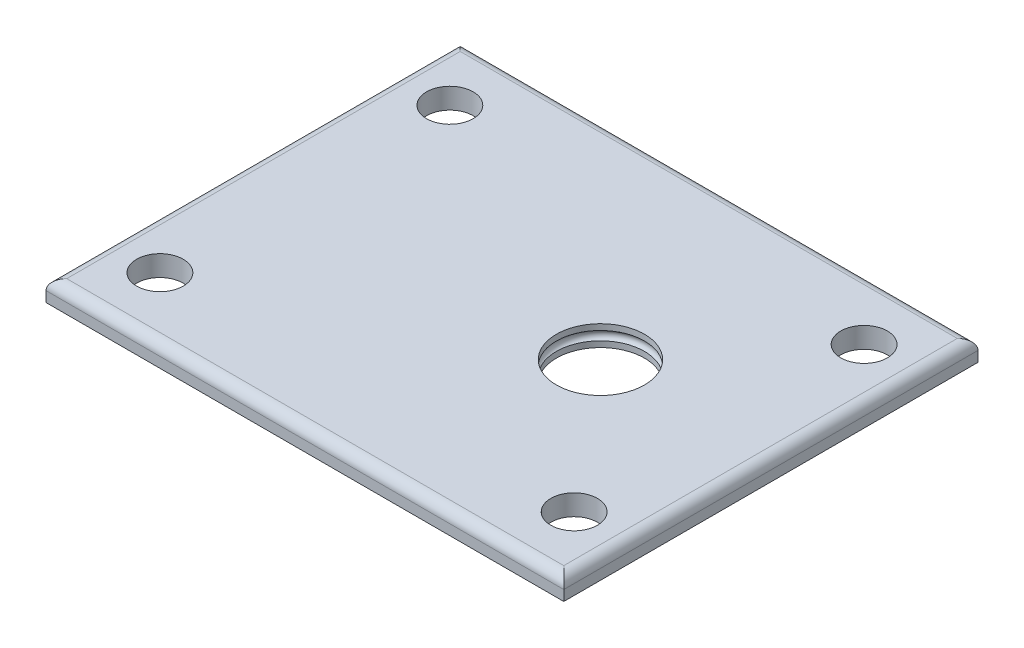
from build123d import *

# Parameters (mm, degrees)
SKETCH2_W           = 50
SKETCH2_H           = 40
SKETCH2_R           = 2.25
BOSS_EXTRUDE1_DEPTH = 2
CUT_EXTRUDE3_REACH  = 58.436
SKETCH4_R           = 4.25
FILLET2_R           = 1


with BuildPart() as part:
    # Sketch2 → Boss-Extrude1 (new body)
    with BuildSketch(Plane(origin=(0, 0, 0), x_dir=(1, 0, 0), z_dir=(0, 1, 0))):
        with Locations((20, -14)):
            Rectangle(SKETCH2_W, SKETCH2_H)
        with Locations(Location((0, 0, 0), (0, 0, 270))):
            Circle(SKETCH2_R, mode=Mode.SUBTRACT)
        with Locations(Location((40, 0, 0), (0, 0, 270))):
            Circle(SKETCH2_R, mode=Mode.SUBTRACT)
        with Locations(Location((0, -28, 0), (0, 0, 270))):
            Circle(SKETCH2_R, mode=Mode.SUBTRACT)
        with Locations(Location((40, -28, 0), (0, 0, 270))):
            Circle(SKETCH2_R, mode=Mode.SUBTRACT)
    extrude(amount=BOSS_EXTRUDE1_DEPTH)

    # Sketch4 → Cut-Extrude3 (cut, up to next)
    with BuildSketch(Plane(origin=(0, 2, 0), x_dir=(1, 0, 0), z_dir=(0, 1, 0)), mode=Mode.PRIVATE) as cut_extrude3_sk1:
        with Locations(Location((28.54, -14, 0), (0, 0, 270))):
            Circle(SKETCH4_R)
    cut_extrude3_tool1 = extrude(cut_extrude3_sk1.sketch, amount=-CUT_EXTRUDE3_REACH, mode=Mode.PRIVATE) & part.part
    add(cut_extrude3_tool1.solids().sort_by_distance((28.54, 2, 14))[0], mode=Mode.SUBTRACT)

    # Sketch7 → Cut-Revolve1 (revolve, cut)
    with BuildSketch(Plane(origin=(0, 0, 14), x_dir=(-1, 0, 0), z_dir=(0, 0, -1)), mode=Mode.PRIVATE) as cut_revolve1_sk:
        with BuildLine():
            Line((-24.54, 1.5), (-24.54, 0.5))
            ThreePointArc((-24.54, 0.5), (-24.04, 1), (-24.54, 1.5))
        make_face()
    revolve(cut_revolve1_sk.sketch.rotate(Axis((28.54, 2, 14), (0, -1, 0)), 270), axis=Axis((28.54, 2, 14), (0, -1, 0)), mode=Mode.SUBTRACT)

    # Fillet2
    fillet2_edges = [part.edges().sort_by_distance(p)[0] for p in [
        (45, 2, 14),
        (20, 2, -6),
        (-5, 2, 14),
        (20, 2, 34),
    ]]
    fillet(fillet2_edges, radius=FILLET2_R)


solid = part.part
